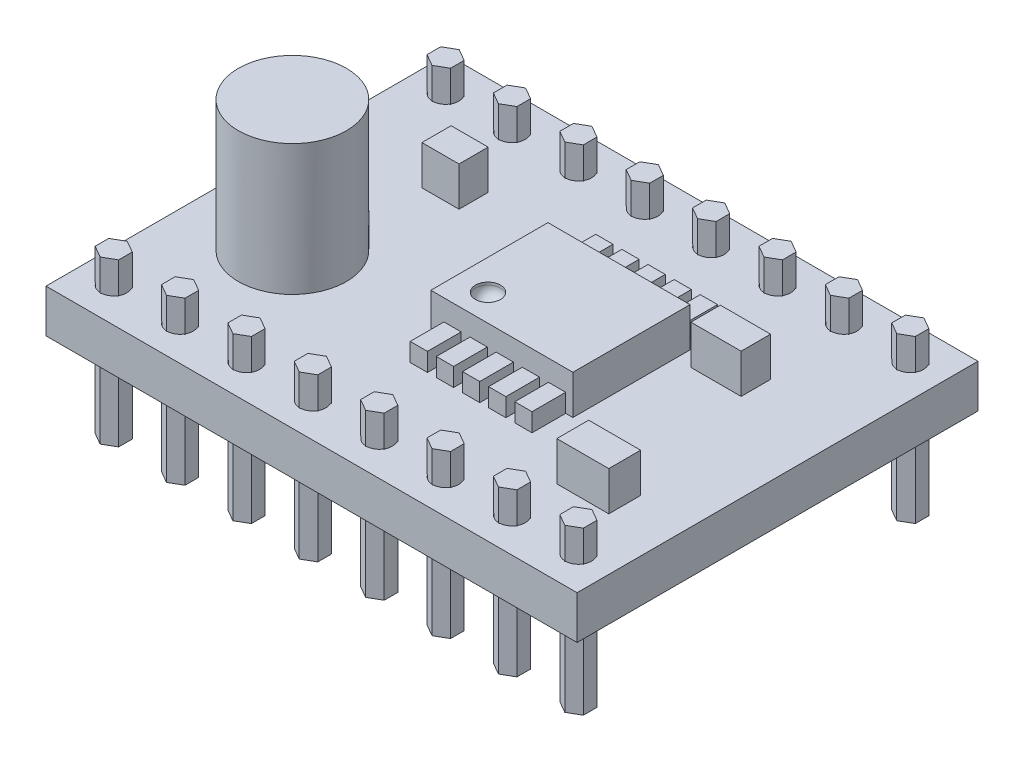
from build123d import *

# Parameters (mm, degrees)
SKETCH1_W                = 20.32
SKETCH1_H                = 15.34
SKETCH1_R                = 0.5
BOSS_EXTRUDE1_DEPTH      = 1.65
SKETCH2_R                = 2.067945433
SKETCH2_W                = 5.43551528
SKETCH2_H                = 4.481389457
SKETCH2_W_2              = 1.988603152
SKETCH2_H_2              = 1.21927291
SKETCH2_W_3              = 1.417873627
SKETCH2_H_3              = 1.116808969
SKETCH2_W_4              = 1.922316379
SKETCH2_H_4              = 1.12687512
BOSS_EXTRUDE2_DEPTH      = 1.5
SKETCH3_R                = 2.067945433
BOSS_EXTRUDE3_DEPTH      = 3.5
BOSS_EXTRUDE4_DEPTH      = 1.2
BOSS_EXTRUDE4_DEPTH_BACK = 5
SKETCH5_W                = 0.660018505
SKETCH5_H                = 1.328885019
BOSS_EXTRUDE5_DEPTH      = 0.7
SKETCH6_R                = 0.477737638
CUT_EXTRUDE1_DEPTH       = 0.5
FILLET1_R                = 0.4


with BuildPart() as part:
    # Sketch1 → Boss-Extrude1 (new body)
    with BuildSketch(Plane(origin=(0, 0, 0), x_dir=(1, 0, 0), z_dir=(0, 1, 0))):
        Rectangle(SKETCH1_W, SKETCH1_H)
        with Locations(Location((1.27, 6.35, 0), (0, 0, 270))):
            Circle(SKETCH1_R, mode=Mode.SUBTRACT)
        with Locations(Location((3.81, 6.35, 0), (0, 0, 270))):
            Circle(SKETCH1_R, mode=Mode.SUBTRACT)
        with Locations(Location((6.35, 6.35, 0), (0, 0, 270))):
            Circle(SKETCH1_R, mode=Mode.SUBTRACT)
        with Locations(Location((8.89, 6.35, 0), (0, 0, 270))):
            Circle(SKETCH1_R, mode=Mode.SUBTRACT)
        with Locations(Location((-1.27, 6.35, 0), (0, 0, 270))):
            Circle(SKETCH1_R, mode=Mode.SUBTRACT)
        with Locations(Location((-3.81, 6.35, 0), (0, 0, 270))):
            Circle(SKETCH1_R, mode=Mode.SUBTRACT)
        with Locations(Location((-6.35, 6.35, 0), (0, 0, 270))):
            Circle(SKETCH1_R, mode=Mode.SUBTRACT)
        with Locations(Location((-8.89, 6.35, 0), (0, 0, 270))):
            Circle(SKETCH1_R, mode=Mode.SUBTRACT)
        with Locations(Location((-8.89, -6.35, 0), (0, 0, 270))):
            Circle(SKETCH1_R, mode=Mode.SUBTRACT)
        with Locations(Location((-6.35, -6.35, 0), (0, 0, 270))):
            Circle(SKETCH1_R, mode=Mode.SUBTRACT)
        with Locations(Location((-3.81, -6.35, 0), (0, 0, 270))):
            Circle(SKETCH1_R, mode=Mode.SUBTRACT)
        with Locations(Location((-1.27, -6.35, 0), (0, 0, 270))):
            Circle(SKETCH1_R, mode=Mode.SUBTRACT)
        with Locations(Location((1.27, -6.35, 0), (0, 0, 270))):
            Circle(SKETCH1_R, mode=Mode.SUBTRACT)
        with Locations(Location((3.81, -6.35, 0), (0, 0, 270))):
            Circle(SKETCH1_R, mode=Mode.SUBTRACT)
        with Locations(Location((6.35, -6.35, 0), (0, 0, 270))):
            Circle(SKETCH1_R, mode=Mode.SUBTRACT)
        with Locations(Location((8.89, -6.35, 0), (0, 0, 270))):
            Circle(SKETCH1_R, mode=Mode.SUBTRACT)
    extrude(amount=BOSS_EXTRUDE1_DEPTH)

    # Sketch2 → Boss-Extrude2 (add)
    with BuildSketch(Plane(origin=(0, 1.65, 0), x_dir=(1, 0, 0), z_dir=(0, 1, 0))):
        with Locations(Location((-6.628677171, -1.773171143, 0), (0, 0, 90))):
            Circle(SKETCH2_R)
        with Locations((1.557739135, 0.294774289)):
            Rectangle(SKETCH2_W, SKETCH2_H)
        with Locations((7.158971345, -3.841116576)):
            Rectangle(SKETCH2_W_2, SKETCH2_H_2)
        with Locations((-5.514727762, 3.335943354)):
            Rectangle(SKETCH2_W_3, SKETCH2_H_3)
        with Locations((5.833235911, 2.535469018)):
            Rectangle(SKETCH2_W_4, SKETCH2_H_4)
    extrude(amount=BOSS_EXTRUDE2_DEPTH)

    # Sketch3 → Boss-Extrude3 (add)
    with BuildSketch(Plane(origin=(0, 3.15, 0), x_dir=(1, 0, 0), z_dir=(0, 1, 0))):
        with Locations(Location((-6.628677171, -1.773171143, 0), (0, 0, 90))):
            Circle(SKETCH3_R)
    extrude(amount=BOSS_EXTRUDE3_DEPTH)

    # Sketch4 → Boss-Extrude4 (add, two sides: drawn at the far end of the back side and taken through both)
    with BuildSketch(Plane(origin=(0, 1.65, 0), x_dir=(1, 0, 0), z_dir=(0, 1, 0)).offset(-BOSS_EXTRUDE4_DEPTH_BACK)):
        Polygon((-5.899463091, 6.610117605), (-6.35, 6.870235211), (-6.800536909, 6.610117605), (-6.800536909, 6.089882395), (-6.35, 5.829764789), (-5.899463091, 6.089882395), align=None)
        Polygon((-8.439463091, 6.610117605), (-8.89, 6.870235211), (-9.340536909, 6.610117605), (-9.340536909, 6.089882395), (-8.89, 5.829764789), (-8.439463091, 6.089882395), align=None)
        Polygon((-3.359463091, 6.610117605), (-3.81, 6.870235211), (-4.260536909, 6.610117605), (-4.260536909, 6.089882395), (-3.81, 5.829764789), (-3.359463091, 6.089882395), align=None)
        Polygon((-0.819463091, 6.610117605), (-1.27, 6.870235211), (-1.720536909, 6.610117605), (-1.720536909, 6.089882395), (-1.27, 5.829764789), (-0.819463091, 6.089882395), align=None)
        Polygon((1.720536909, 6.610117605), (1.27, 6.870235211), (0.819463091, 6.610117605), (0.819463091, 6.089882395), (1.27, 5.829764789), (1.720536909, 6.089882395), align=None)
        Polygon((4.260536909, 6.610117605), (3.81, 6.870235211), (3.359463091, 6.610117605), (3.359463091, 6.089882395), (3.81, 5.829764789), (4.260536909, 6.089882395), align=None)
        Polygon((6.800536909, 6.610117605), (6.35, 6.870235211), (5.899463091, 6.610117605), (5.899463091, 6.089882395), (6.35, 5.829764789), (6.800536909, 6.089882395), align=None)
        Polygon((9.340536909, 6.610117605), (8.89, 6.870235211), (8.439463091, 6.610117605), (8.439463091, 6.089882395), (8.89, 5.829764789), (9.340536909, 6.089882395), align=None)
        Polygon((-5.899463091, -6.089882395), (-6.35, -5.829764789), (-6.800536909, -6.089882395), (-6.800536909, -6.610117605), (-6.35, -6.870235211), (-5.899463091, -6.610117605), align=None)
        Polygon((-3.359463091, -6.089882395), (-3.81, -5.829764789), (-4.260536909, -6.089882395), (-4.260536909, -6.610117605), (-3.81, -6.870235211), (-3.359463091, -6.610117605), align=None)
        Polygon((-0.819463091, -6.089882395), (-1.27, -5.829764789), (-1.720536909, -6.089882395), (-1.720536909, -6.610117605), (-1.27, -6.870235211), (-0.819463091, -6.610117605), align=None)
        Polygon((1.720536909, -6.089882395), (1.27, -5.829764789), (0.819463091, -6.089882395), (0.819463091, -6.610117605), (1.27, -6.870235211), (1.720536909, -6.610117605), align=None)
        Polygon((4.260536909, -6.089882395), (3.81, -5.829764789), (3.359463091, -6.089882395), (3.359463091, -6.610117605), (3.81, -6.870235211), (4.260536909, -6.610117605), align=None)
        Polygon((6.800536909, -6.089882395), (6.35, -5.829764789), (5.899463091, -6.089882395), (5.899463091, -6.610117605), (6.35, -6.870235211), (6.800536909, -6.610117605), align=None)
        Polygon((9.340536909, -6.089882395), (8.89, -5.829764789), (8.439463091, -6.089882395), (8.439463091, -6.610117605), (8.89, -6.870235211), (9.340536909, -6.610117605), align=None)
        Polygon((-8.439463091, -6.089882395), (-8.89, -5.829764789), (-9.340536909, -6.089882395), (-9.340536909, -6.610117605), (-8.89, -6.870235211), (-8.439463091, -6.610117605), align=None)
    extrude(amount=BOSS_EXTRUDE4_DEPTH + BOSS_EXTRUDE4_DEPTH_BACK)

    # Sketch5 → Boss-Extrude5 (add)
    with BuildSketch(Plane(origin=(0, 1.65, 0), x_dir=(1, 0, 0), z_dir=(0, 1, 0))):
        with Locations((-0.330009253, 3.199911528)):
            Rectangle(SKETCH5_W, SKETCH5_H)
        with Locations((0.669990747, 3.199911528)):
            Rectangle(SKETCH5_W, SKETCH5_H)
        with Locations((1.669990747, 3.199911528)):
            Rectangle(SKETCH5_W, SKETCH5_H)
        with Locations((2.669990747, 3.199911528)):
            Rectangle(SKETCH5_W, SKETCH5_H)
        with Locations((3.669990747, 3.199911528)):
            Rectangle(SKETCH5_W, SKETCH5_H)
        with Locations((0.669990747, -2.570088473)):
            Rectangle(SKETCH5_W, SKETCH5_H)
        with Locations((1.669990747, -2.570088473)):
            Rectangle(SKETCH5_W, SKETCH5_H)
        with Locations((2.669990747, -2.570088473)):
            Rectangle(SKETCH5_W, SKETCH5_H)
        with Locations((3.669990747, -2.570088473)):
            Rectangle(SKETCH5_W, SKETCH5_H)
        with Locations((-0.330009253, -2.570088473)):
            Rectangle(SKETCH5_W, SKETCH5_H)
    extrude(amount=BOSS_EXTRUDE5_DEPTH)

    # Sketch6 → Cut-Extrude1 (cut)
    with BuildSketch(Plane(origin=(0, 3.15, 0), x_dir=(1, 0, 0), z_dir=(0, 1, 0))):
        with Locations(Location((0, -0.919346234, 0), (0, 0, 270))):
            Circle(SKETCH6_R)
    extrude(amount=-CUT_EXTRUDE1_DEPTH, mode=Mode.SUBTRACT)

    # Fillet1
    fillet1_edges = [part.edges().sort_by_distance(p)[0] for p in [
        (0, 2.65, 0.441608596),
    ]]
    fillet(fillet1_edges, radius=FILLET1_R)


solid = part.part
